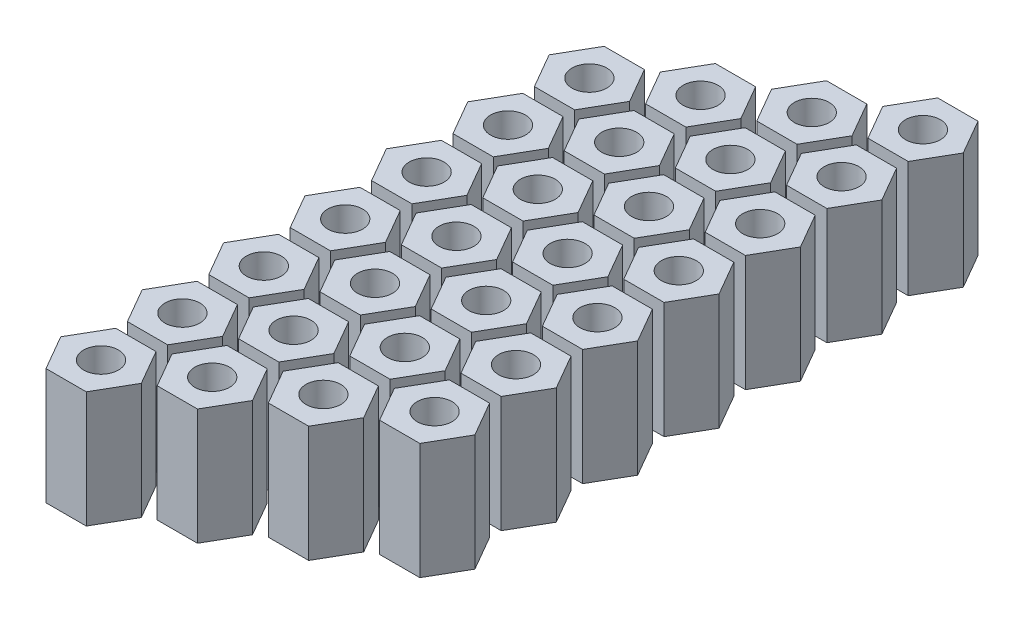
from build123d import *

# Parameters (mm, degrees)
SKETCH1_R           = 1.5
BOSS_EXTRUDE1_DEPTH = 10
LPATTERN1_COUNT     = 7
LPATTERN1_PITCH     = 7
LPATTERN1_2_COUNT   = 4
LPATTERN1_2_PITCH   = 7


with BuildPart() as part:
    # Sketch1 → Boss-Extrude1 (new body)
    with BuildSketch(Plane(origin=(0, 0, 0), x_dir=(1, 0, 0), z_dir=(0, 1, 0))):
        Polygon((3.464101615, 0), (1.732050808, 3), (-1.732050808, 3), (-3.464101615, 0), (-1.732050808, -3), (1.732050808, -3), align=None)
        with Locations(Location((0, 0, 0), (0, 0, 270))):
            Circle(SKETCH1_R, mode=Mode.SUBTRACT)
    extrude(amount=BOSS_EXTRUDE1_DEPTH)


with BuildPart() as lpattern1_1:
    # LPattern1: pattern copy
    add(part.part.moved(Location(Vector(0, 0, 1) * (1 * LPATTERN1_PITCH))))


with BuildPart() as lpattern1_2:
    # LPattern1: pattern copy
    add(part.part.moved(Location(Vector(0, 0, 1) * (2 * LPATTERN1_PITCH))))


with BuildPart() as lpattern1_3:
    # LPattern1: pattern copy
    add(part.part.moved(Location(Vector(0, 0, 1) * (3 * LPATTERN1_PITCH))))


with BuildPart() as lpattern1_4:
    # LPattern1: pattern copy
    add(part.part.moved(Location(Vector(0, 0, 1) * (4 * LPATTERN1_PITCH))))


with BuildPart() as lpattern1_5:
    # LPattern1: pattern copy
    add(part.part.moved(Location(Vector(0, 0, 1) * (5 * LPATTERN1_PITCH))))


with BuildPart() as lpattern1_6:
    # LPattern1: pattern copy
    add(part.part.moved(Location(Vector(0, 0, 1) * (6 * LPATTERN1_PITCH))))


with BuildPart() as lpattern1_2_1:
    # LPattern1 2: pattern copy
    add(part.part.moved(Location(Vector(-0.8660254037844387, 0, 0.5000000000000001) * (1 * LPATTERN1_2_PITCH))))


with BuildPart() as lpattern1_2_2:
    # LPattern1 2: pattern copy
    add(part.part.moved(Location(Vector(-0.8660254037844387, 0, 0.5000000000000001) * (2 * LPATTERN1_2_PITCH))))


with BuildPart() as lpattern1_2_3:
    # LPattern1 2: pattern copy
    add(part.part.moved(Location(Vector(-0.8660254037844387, 0, 0.5000000000000001) * (3 * LPATTERN1_2_PITCH))))


with BuildPart() as lpattern1_2_4:
    # LPattern1 2: pattern copy
    add(lpattern1_1.part.moved(Location(Vector(-0.8660254037844387, 0, 0.5000000000000001) * (1 * LPATTERN1_2_PITCH))))


with BuildPart() as lpattern1_2_5:
    # LPattern1 2: pattern copy
    add(lpattern1_1.part.moved(Location(Vector(-0.8660254037844387, 0, 0.5000000000000001) * (2 * LPATTERN1_2_PITCH))))


with BuildPart() as lpattern1_2_6:
    # LPattern1 2: pattern copy
    add(lpattern1_1.part.moved(Location(Vector(-0.8660254037844387, 0, 0.5000000000000001) * (3 * LPATTERN1_2_PITCH))))


with BuildPart() as lpattern1_2_7:
    # LPattern1 2: pattern copy
    add(lpattern1_2.part.moved(Location(Vector(-0.8660254037844387, 0, 0.5000000000000001) * (1 * LPATTERN1_2_PITCH))))


with BuildPart() as lpattern1_2_8:
    # LPattern1 2: pattern copy
    add(lpattern1_2.part.moved(Location(Vector(-0.8660254037844387, 0, 0.5000000000000001) * (2 * LPATTERN1_2_PITCH))))


with BuildPart() as lpattern1_2_9:
    # LPattern1 2: pattern copy
    add(lpattern1_2.part.moved(Location(Vector(-0.8660254037844387, 0, 0.5000000000000001) * (3 * LPATTERN1_2_PITCH))))


with BuildPart() as lpattern1_2_10:
    # LPattern1 2: pattern copy
    add(lpattern1_3.part.moved(Location(Vector(-0.8660254037844387, 0, 0.5000000000000001) * (1 * LPATTERN1_2_PITCH))))


with BuildPart() as lpattern1_2_11:
    # LPattern1 2: pattern copy
    add(lpattern1_3.part.moved(Location(Vector(-0.8660254037844387, 0, 0.5000000000000001) * (2 * LPATTERN1_2_PITCH))))


with BuildPart() as lpattern1_2_12:
    # LPattern1 2: pattern copy
    add(lpattern1_3.part.moved(Location(Vector(-0.8660254037844387, 0, 0.5000000000000001) * (3 * LPATTERN1_2_PITCH))))


with BuildPart() as lpattern1_2_13:
    # LPattern1 2: pattern copy
    add(lpattern1_4.part.moved(Location(Vector(-0.8660254037844387, 0, 0.5000000000000001) * (1 * LPATTERN1_2_PITCH))))


with BuildPart() as lpattern1_2_14:
    # LPattern1 2: pattern copy
    add(lpattern1_4.part.moved(Location(Vector(-0.8660254037844387, 0, 0.5000000000000001) * (2 * LPATTERN1_2_PITCH))))


with BuildPart() as lpattern1_2_15:
    # LPattern1 2: pattern copy
    add(lpattern1_4.part.moved(Location(Vector(-0.8660254037844387, 0, 0.5000000000000001) * (3 * LPATTERN1_2_PITCH))))


with BuildPart() as lpattern1_2_16:
    # LPattern1 2: pattern copy
    add(lpattern1_5.part.moved(Location(Vector(-0.8660254037844387, 0, 0.5000000000000001) * (1 * LPATTERN1_2_PITCH))))


with BuildPart() as lpattern1_2_17:
    # LPattern1 2: pattern copy
    add(lpattern1_5.part.moved(Location(Vector(-0.8660254037844387, 0, 0.5000000000000001) * (2 * LPATTERN1_2_PITCH))))


with BuildPart() as lpattern1_2_18:
    # LPattern1 2: pattern copy
    add(lpattern1_5.part.moved(Location(Vector(-0.8660254037844387, 0, 0.5000000000000001) * (3 * LPATTERN1_2_PITCH))))


with BuildPart() as lpattern1_2_19:
    # LPattern1 2: pattern copy
    add(lpattern1_6.part.moved(Location(Vector(-0.8660254037844387, 0, 0.5000000000000001) * (1 * LPATTERN1_2_PITCH))))


with BuildPart() as lpattern1_2_20:
    # LPattern1 2: pattern copy
    add(lpattern1_6.part.moved(Location(Vector(-0.8660254037844387, 0, 0.5000000000000001) * (2 * LPATTERN1_2_PITCH))))


with BuildPart() as lpattern1_2_21:
    # LPattern1 2: pattern copy
    add(lpattern1_6.part.moved(Location(Vector(-0.8660254037844387, 0, 0.5000000000000001) * (3 * LPATTERN1_2_PITCH))))


solid = Compound([part.part, lpattern1_1.part, lpattern1_2.part, lpattern1_3.part, lpattern1_4.part, lpattern1_5.part, lpattern1_6.part, lpattern1_2_1.part, lpattern1_2_2.part, lpattern1_2_3.part, lpattern1_2_4.part, lpattern1_2_5.part, lpattern1_2_6.part, lpattern1_2_7.part, lpattern1_2_8.part, lpattern1_2_9.part, lpattern1_2_10.part, lpattern1_2_11.part, lpattern1_2_12.part, lpattern1_2_13.part, lpattern1_2_14.part, lpattern1_2_15.part, lpattern1_2_16.part, lpattern1_2_17.part, lpattern1_2_18.part, lpattern1_2_19.part, lpattern1_2_20.part, lpattern1_2_21.part])
